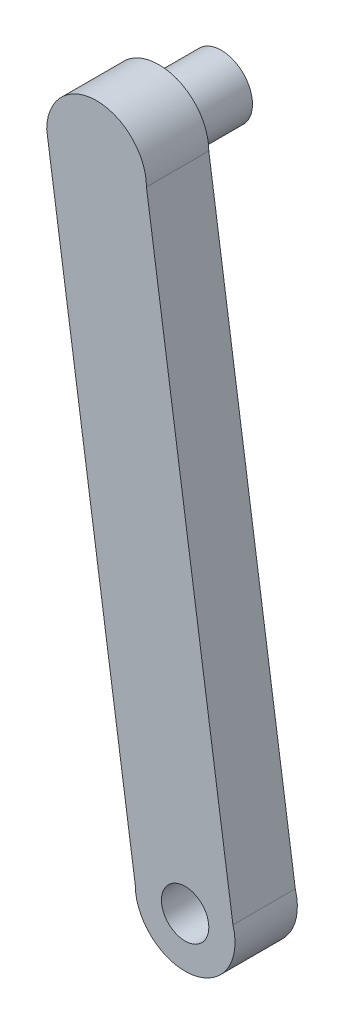
from build123d import *

# Parameters (mm, degrees)
SKETCH1_R           = 1.9
BOSS_EXTRUDE1_DEPTH = 5
SKETCH2_R           = 2.5
BOSS_EXTRUDE2_DEPTH = 5


with BuildPart() as part:
    # Sketch1 → Boss-Extrude1 (new body)
    with BuildSketch(Plane.XY):
        with BuildLine():
            Line((13.1, 0), (6, 48.912409848))
            ThreePointArc((6, 48.912409848), (10, 52.912409848), (14, 48.912409848))
            Line((14, 48.912409848), (20.934913045, 1.137295889))
            ThreePointArc((20.934913045, 1.137295889), (17.674607614, -3.958513116), (13.1, 0))
        make_face()
        with Locations((17.1, 0)):
            Circle(SKETCH1_R, mode=Mode.SUBTRACT)
    extrude(amount=BOSS_EXTRUDE1_DEPTH)

    # Sketch2 → Boss-Extrude2 (add)
    with BuildSketch(Plane(origin=(0, 0, 0), x_dir=(-1, 0, 0), z_dir=(0, 0, -1))):
        with Locations(Location((-10, 48.912409848, 0), (0, 0, 180))):
            Circle(SKETCH2_R)
    extrude(amount=BOSS_EXTRUDE2_DEPTH)


solid = part.part
